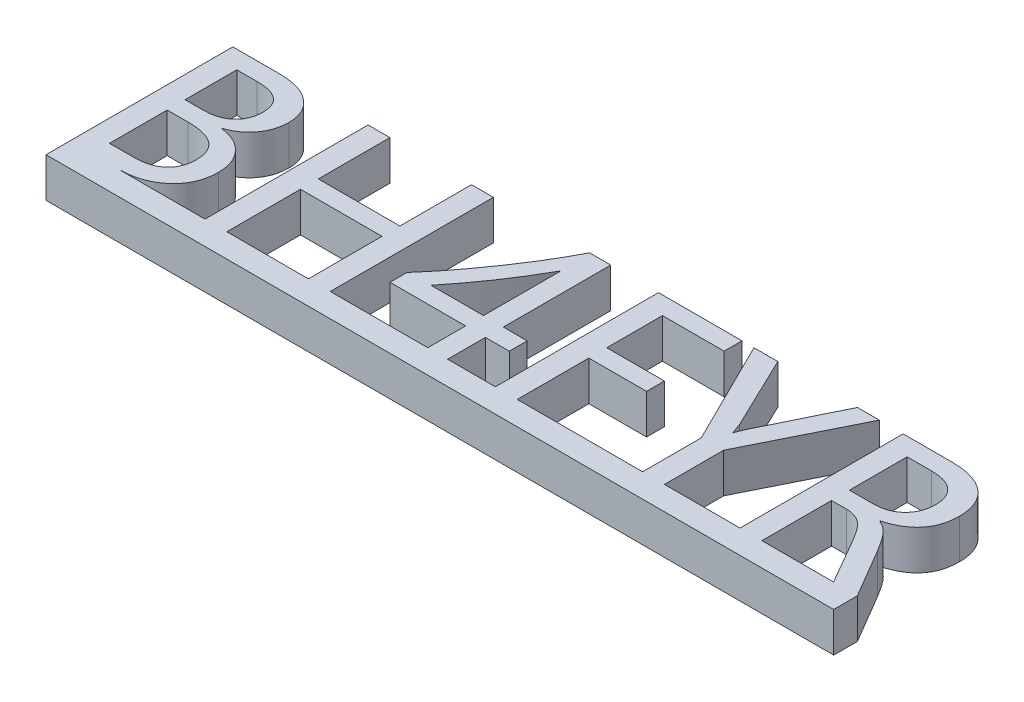
from build123d import *

# Parameters (mm, degrees)
EXTRUDE_1_DEPTH   = 5
EXTRUDE_1_2_DEPTH = 5
EXTRUDE_1_3_DEPTH = 5
EXTRUDE_1_4_DEPTH = 5
EXTRUDE_1_5_DEPTH = 5
EXTRUDE_1_6_DEPTH = 5
SKETCH_2_W        = 99.604130145
SKETCH_2_H        = 5
EXTRUDE_2_DEPTH   = 3


with BuildPart() as part:
    # 草图1 → 凸台-拉伸1 (new body)
    with BuildSketch(Plane(origin=(0, 0, 0), x_dir=(1, 0, 0), z_dir=(0, 1, 0))):
        with BuildLine():
            Line((-60.603252627, 13.579293004), (-60.603252627, 34.20439066))
            Line((-60.603252627, 34.20439066), (-54.645240423, 34.20439066))
            add(Edge.make_bspline(
                [(-54.645240423, 34.20439066), (-54.428893814, 34.201297742), (-54.005718834, 34.195247979), (-53.387768051, 34.128118516), (-52.800842266, 34.03405137), (-52.248046677, 33.892656612), (-51.730624922, 33.706297073), (-51.245419018, 33.483374879), (-50.79476649, 33.217538165), (-50.37779163, 32.917466537), (-50.006483529, 32.578643253), (-49.674636573, 32.216605934), (-49.399805291, 31.821509994), (-49.173552021, 31.400640485), (-48.995834941, 30.955192463), (-48.869510035, 30.48180239), (-48.793729306, 29.982018115), (-48.785658545, 29.63920602), (-48.781550311, 29.46470549)],
                knots=[0, 0, 0, 0, 1.224261737, 2.394661691, 3.515146388, 4.587215054, 5.619395989, 6.624798919, 7.605471068, 8.57712794, 9.527493793, 10.446434834, 11.351717401, 12.244303816, 13.146360503, 14.060259964, 15.012620412, 16, 16, 16, 16], degree=3))
            add(Edge.make_bspline(
                [(-48.781550311, 29.46470549), (-48.784780646, 29.324420511), (-48.791136054, 29.048421733), (-48.835315401, 28.639708576), (-48.908541615, 28.243695122), (-49.016759417, 27.860780673), (-49.149475973, 27.4892236), (-49.31518073, 27.132232899), (-49.509816053, 26.786724577), (-49.73220967, 26.455869473), (-49.979238638, 26.140705184), (-50.251536537, 25.849005244), (-50.547163938, 25.580570614), (-50.866463452, 25.337923737), (-51.204752951, 25.114935736), (-51.570116178, 24.924215876), (-51.953656087, 24.749400431), (-52.222198507, 24.65488783), (-52.357929669, 24.607117704)],
                knots=[0, 0, 0, 0, 1.04030745, 2.046716516, 3.045215807, 4.023467983, 4.994650581, 5.968405467, 6.93851832, 7.932849284, 8.922183699, 9.905200704, 10.888793697, 11.879844052, 12.87692428, 13.889644648, 14.933349214, 16, 16, 16, 16], degree=3))
            Line((-52.357929669, 24.607117704), (-52.357929669, 24.552096483))
            add(Edge.make_bspline(
                [(-52.357929669, 24.552096483), (-52.188572445, 24.528155982), (-51.855559113, 24.481080896), (-51.370405404, 24.372937401), (-50.913322579, 24.22033896), (-50.47977258, 24.04277619), (-50.075431205, 23.823398209), (-49.698196045, 23.571799582), (-49.343895409, 23.286718525), (-49.020871361, 22.964957143), (-48.72593114, 22.618487984), (-48.472905964, 22.244223552), (-48.255399116, 21.850374757), (-48.07679342, 21.432219183), (-47.945230428, 20.98834216), (-47.846132826, 20.523403635), (-47.78638833, 20.035357641), (-47.779134681, 19.702533982), (-47.775447987, 19.533375121)],
                knots=[0, 0, 0, 0, 1.092706737, 2.148629406, 3.170390158, 4.168422902, 5.138436716, 6.104215669, 7.06245633, 8.03909295, 9.013323217, 9.965217964, 10.920529338, 11.884456504, 12.864208971, 13.873863167, 14.919383061, 16, 16, 16, 16], degree=3))
            add(Edge.make_bspline(
                [(-47.775447987, 19.533375121), (-47.779792867, 19.31685208), (-47.788338371, 18.890994847), (-47.883387818, 18.270146806), (-48.025370695, 17.678279683), (-48.237193031, 17.12225777), (-48.500880384, 16.595317861), (-48.825396109, 16.099665648), (-49.214037102, 15.640352447), (-49.652411091, 15.212253137), (-50.138608195, 14.82986393), (-50.660328633, 14.493044626), (-51.215612128, 14.208899094), (-51.805694782, 13.982333149), (-52.425596129, 13.799725952), (-53.079207526, 13.670554869), (-53.767111899, 13.596311871), (-54.236331466, 13.585050845), (-54.476246673, 13.579293004)],
                knots=[0, 0, 0, 0, 1.031947005, 2.029632022, 2.988950409, 3.930190083, 4.860749625, 5.794889745, 6.748554408, 7.725117402, 8.712713111, 9.693743881, 10.68301842, 11.682111326, 12.704383645, 13.761949426, 14.855669279, 16, 16, 16, 16], degree=3))
            Line((-54.476246673, 13.579293004), (-60.603252627, 13.579293004))
        make_face()
        with BuildLine():
            Line((-57.836471234, 31.94066043), (-57.836471234, 25.400995319))
            Line((-57.836471234, 25.400995319), (-55.509859608, 25.400995319))
            add(Edge.make_bspline(
                [(-55.509859608, 25.400995319), (-55.359102608, 25.404174872), (-55.06611866, 25.410354074), (-54.638921385, 25.453579939), (-54.237473835, 25.526777994), (-53.861854216, 25.634191822), (-53.510426824, 25.767678629), (-53.181633516, 25.928970915), (-52.877268139, 26.121254581), (-52.603131224, 26.347120729), (-52.352451198, 26.594588196), (-52.137027666, 26.869898013), (-51.954563306, 27.16823961), (-51.803635125, 27.487852925), (-51.691278759, 27.83171658), (-51.608291059, 28.197341996), (-51.555936339, 28.585470773), (-51.550901371, 28.852753466), (-51.548331704, 28.989164938)],
                knots=[0, 0, 0, 0, 1.194671247, 2.321746236, 3.398942989, 4.424310126, 5.413453364, 6.374575168, 7.32214346, 8.259360503, 9.184364407, 10.108610566, 11.022064294, 11.950963703, 12.90307127, 13.882798053, 14.919456278, 16, 16, 16, 16], degree=3))
            add(Edge.make_bspline(
                [(-51.548331704, 28.989164938), (-51.55143959, 29.10851691), (-51.55747183, 29.340172697), (-51.601410673, 29.675698436), (-51.671428335, 29.989560044), (-51.771796982, 30.281116036), (-51.909108484, 30.546969664), (-52.068105787, 30.792189272), (-52.261443312, 31.009861187), (-52.478370865, 31.210560448), (-52.731071455, 31.380350142), (-53.010099139, 31.531425316), (-53.315912189, 31.661919702), (-53.6543002, 31.761490788), (-54.018622797, 31.846110174), (-54.4148803, 31.89728874), (-54.838403522, 31.934814627), (-55.13116635, 31.938673457), (-55.28191455, 31.94066043)],
                knots=[0, 0, 0, 0, 1.053285166, 2.044370124, 2.981290725, 3.888262112, 4.757057278, 5.616568525, 6.46069648, 7.320207727, 8.218289928, 9.139305578, 10.118650866, 11.146493088, 12.248964571, 13.416581374, 14.669756982, 16, 16, 16, 16], degree=3))
            Line((-55.28191455, 31.94066043), (-57.836471234, 31.94066043))
        make_face(mode=Mode.SUBTRACT)
        with BuildLine():
            Line((-57.836471234, 23.137265089), (-57.836471234, 15.843023235))
            Line((-57.836471234, 15.843023235), (-54.755282864, 15.843023235))
            add(Edge.make_bspline(
                [(-54.755282864, 15.843023235), (-54.59139082, 15.845726189), (-54.273369973, 15.85097108), (-53.811345998, 15.900470721), (-53.377229266, 15.972954372), (-52.971664667, 16.078293868), (-52.595129293, 16.216455443), (-52.247145008, 16.38583027), (-51.928116587, 16.586093536), (-51.63934708, 16.816587404), (-51.377867057, 17.070822921), (-51.155162677, 17.355385115), (-50.962125195, 17.660889244), (-50.811704327, 17.992856341), (-50.686589918, 18.345760495), (-50.602224153, 18.724425785), (-50.549732845, 19.127083964), (-50.544771693, 19.403511624), (-50.54222938, 19.545165383)],
                knots=[0, 0, 0, 0, 1.234915879, 2.396266363, 3.498520061, 4.549933063, 5.54962698, 6.516751377, 7.461900337, 8.382540583, 9.297230871, 10.203998833, 11.099949659, 12.014426733, 12.945021275, 13.917524352, 14.932847372, 16, 16, 16, 16], degree=3))
            add(Edge.make_bspline(
                [(-50.54222938, 19.545165383), (-50.546417703, 19.690727266), (-50.554519353, 19.972293757), (-50.605186974, 20.382014843), (-50.693362656, 20.763966566), (-50.826117179, 21.115541945), (-50.985915819, 21.442732127), (-51.188944283, 21.738720337), (-51.426484206, 22.007976236), (-51.699000287, 22.249271196), (-52.009955236, 22.459478204), (-52.35848083, 22.638157605), (-52.739795614, 22.797271454), (-53.159344999, 22.920926422), (-53.612605442, 23.018571636), (-54.10224866, 23.089857993), (-54.628954888, 23.12663613), (-54.992348497, 23.133648937), (-55.179732283, 23.137265089)],
                knots=[0, 0, 0, 0, 1.043087874, 2.017688869, 2.95354105, 3.844628149, 4.705278241, 5.556714445, 6.408047138, 7.272630541, 8.157913097, 9.09008545, 10.075075167, 11.114523712, 12.219321121, 13.395592654, 14.657038276, 16, 16, 16, 16], degree=3))
            Line((-55.179732283, 23.137265089), (-57.836471234, 23.137265089))
        make_face(mode=Mode.SUBTRACT)
    extrude(amount=EXTRUDE_1_DEPTH)



with BuildPart() as body_2:
    # 草图1 → Extrude 1 2 (new body)
    with BuildSketch(Plane(origin=(0, 0, 0), x_dir=(1, 0, 0), z_dir=(0, 1, 0))):
        Polygon((-27.653401493, 13.579293004), (-30.420182886, 13.579293004), (-30.420182886, 22.885739508), (-40.732731714, 22.885739508), (-40.732731714, 13.579293004), (-43.499513107, 13.579293004), (-43.499513107, 34.20439066), (-40.732731714, 34.20439066), (-40.732731714, 25.149469738), (-30.420182886, 25.149469738), (-30.420182886, 34.20439066), (-27.653401493, 34.20439066), align=None)
    extrude(amount=EXTRUDE_1_2_DEPTH)


with BuildPart() as body_3:
    # 草图1 → Extrude 1 3 (new body)
    with BuildSketch(Plane(origin=(0, 0, 0), x_dir=(1, 0, 0), z_dir=(0, 1, 0))):
        with BuildLine():
            Line((-12.813392204, 34.20439066), (-12.813392204, 20.622009277))
            Line((-12.813392204, 20.622009277), (-9.795085229, 20.622009277))
            Line((-9.795085229, 20.622009277), (-9.795085229, 18.358279046))
            Line((-9.795085229, 18.358279046), (-12.813392204, 18.358279046))
            Line((-12.813392204, 18.358279046), (-12.813392204, 13.579293004))
            Line((-12.813392204, 13.579293004), (-15.328648015, 13.579293004))
            Line((-15.328648015, 13.579293004), (-15.328648015, 18.358279046))
            Line((-15.328648015, 18.358279046), (-24.8866201, 18.358279046))
            Line((-24.8866201, 18.358279046), (-24.8866201, 20.504106661))
            add(Edge.make_bspline(
                [(-24.8866201, 20.504106661), (-24.457193161, 20.998846905), (-23.578585111, 22.011086056), (-22.303006444, 23.621057629), (-21.021282196, 25.338361795), (-19.961945969, 26.833617371), (-19.131929687, 28.066204256), (-18.526339968, 28.982712032), (-17.953108861, 29.887983683), (-17.405471785, 30.776782908), (-16.886630424, 31.651295187), (-16.399771445, 32.515186534), (-15.934205465, 33.360574991), (-15.644330363, 33.925952129), (-15.501571852, 34.20439066)],
                knots=[0, 0, 0, 0, 1.416740294, 2.898652394, 4.441123769, 6.05109865, 6.86129983, 7.654998932, 8.426874509, 9.17862826, 9.912856759, 10.625918725, 11.323288568, 12, 12, 12, 12], degree=3))
            Line((-15.501571852, 34.20439066), (-12.813392204, 34.20439066))
        make_face()
        with BuildLine():
            Line((-21.966565306, 20.622009277), (-15.328648015, 20.622009277))
            Line((-15.328648015, 20.622009277), (-15.328648015, 30.419716681))
            add(Edge.make_bspline(
                [(-15.328648015, 30.419716681), (-15.559764648, 30.007172568), (-16.020610026, 29.184561724), (-16.747965627, 27.973562899), (-17.492446423, 26.777535961), (-18.273914325, 25.594101369), (-19.099808752, 24.398431791), (-19.988176403, 23.173226194), (-20.94802573, 21.906676082), (-21.621705229, 21.056975481), (-21.966565306, 20.622009277)],
                knots=[0, 0, 0, 0, 0.957687981, 1.909624916, 2.860807221, 3.810856455, 4.781631678, 5.803821085, 6.875764471, 8, 8, 8, 8], degree=3))
        make_face(mode=Mode.SUBTRACT)
    extrude(amount=EXTRUDE_1_3_DEPTH)


with BuildPart() as body_4:
    # 草图1 → Extrude 1 4 (new body)
    with BuildSketch(Plane(origin=(0, 0, 0), x_dir=(1, 0, 0), z_dir=(0, 1, 0))):
        Polygon((3.787296154, 31.94066043), (-4.009996862, 31.94066043), (-4.009996862, 24.897944157), (3.284244992, 24.897944157), (3.284244992, 22.634213926), (-4.009996862, 22.634213926), (-4.009996862, 13.579293004), (-6.776778255, 13.579293004), (-6.776778255, 34.20439066), (3.787296154, 34.20439066), align=None)
    extrude(amount=EXTRUDE_1_4_DEPTH)


with BuildPart() as body_5:
    # 草图1 → Extrude 1 5 (new body)
    with BuildSketch(Plane(origin=(0, 0, 0), x_dir=(1, 0, 0), z_dir=(0, 1, 0))):
        with BuildLine():
            Line((21.142561255, 34.20439066), (14.602896144, 21.062179044))
            Line((14.602896144, 21.062179044), (14.602896144, 13.579293004))
            Line((14.602896144, 13.579293004), (11.836114751, 13.579293004))
            Line((11.836114751, 13.579293004), (11.836114751, 20.995367562))
            Line((11.836114751, 20.995367562), (5.296449641, 34.20439066))
            Line((5.296449641, 34.20439066), (8.314756615, 34.20439066))
            Line((8.314756615, 34.20439066), (12.775405594, 24.917594593))
            add(Edge.make_bspline(
                [(12.775405594, 24.917594593), (12.779462812, 24.909789929), (12.793855105, 24.882104213), (12.8150552, 24.816288906), (12.855842399, 24.710841435), (12.910211629, 24.562987824), (12.976058258, 24.373546715), (13.059934212, 24.144766251), (13.157130511, 23.874519411), (13.228528257, 23.680873753), (13.266666494, 23.577434856)],
                knots=[0, 0, 0, 0, 0.147743287, 0.524094158, 1.158224838, 2.050139749, 3.171648737, 4.530208759, 6.146556032, 8, 8, 8, 8], degree=3))
            Line((13.266666494, 23.577434856), (13.305967366, 23.577434856))
            add(Edge.make_bspline(
                [(13.305967366, 23.577434856), (13.33484103, 23.677404097), (13.395123965, 23.886121612), (13.516204335, 24.207118537), (13.665166144, 24.549729806), (13.778076917, 24.784346679), (13.836529139, 24.905804331)],
                knots=[0, 0, 0, 0, 0.871330364, 1.819178638, 2.871021336, 4, 4, 4, 4], degree=3))
            Line((13.836529139, 24.905804331), (18.375779862, 34.20439066))
            Line((18.375779862, 34.20439066), (21.142561255, 34.20439066))
        make_face()
    extrude(amount=EXTRUDE_1_5_DEPTH)


with BuildPart() as body_6:
    # 草图1 → Extrude 1 6 (new body)
    with BuildSketch(Plane(origin=(0, 0, 0), x_dir=(1, 0, 0), z_dir=(0, 1, 0))):
        with BuildLine():
            Line((39.000877518, 13.579293004), (35.982570544, 13.579293004))
            Line((35.982570544, 13.579293004), (32.634136245, 19.384031807))
            add(Edge.make_bspline(
                [(32.634136245, 19.384031807), (32.552383014, 19.523363245), (32.39374497, 19.793728911), (32.151782207, 20.17679705), (31.91435823, 20.525370648), (31.683789714, 20.839823269), (31.456594646, 21.120283809), (31.23093888, 21.363060439), (31.017925264, 21.578459515), (30.734092963, 21.80728338), (30.365263918, 22.043704536), (29.878949931, 22.239872232), (29.353258482, 22.361842913), (28.989007671, 22.375624319), (28.802301219, 22.382688345)],
                knots=[0, 0, 0, 0, 1.130740819, 2.194145845, 3.170827357, 4.082355974, 4.923051463, 5.695349335, 6.402154369, 7.0409034, 8.244273015, 9.453324277, 10.69463355, 12, 12, 12, 12], degree=3))
            Line((28.802301219, 22.382688345), (26.927649622, 22.382688345))
            Line((26.927649622, 22.382688345), (26.927649622, 13.579293004))
            Line((26.927649622, 13.579293004), (24.160868229, 13.579293004))
            Line((24.160868229, 13.579293004), (24.160868229, 34.20439066))
            Line((24.160868229, 34.20439066), (30.382196276, 34.20439066))
            add(Edge.make_bspline(
                [(30.382196276, 34.20439066), (30.623407887, 34.199838673), (31.093686119, 34.19096389), (31.779177596, 34.1227643), (32.426230245, 34.014983369), (33.033173664, 33.858939385), (33.598415441, 33.653273954), (34.123647868, 33.405093529), (34.610936823, 33.115098632), (35.051120894, 32.774299374), (35.4495557, 32.399252534), (35.795356459, 31.982084566), (36.085416048, 31.528110627), (36.329287045, 31.040706736), (36.512609496, 30.51598985), (36.641734679, 29.955830207), (36.72149504, 29.360882281), (36.731843387, 28.951429), (36.737147288, 28.741569444)],
                knots=[0, 0, 0, 0, 1.218895871, 2.376420411, 3.477962383, 4.53141632, 5.538862009, 6.513239363, 7.463634743, 8.398567947, 9.321158646, 10.2239854, 11.129406106, 12.03842662, 12.972374671, 13.931150821, 14.93964027, 16, 16, 16, 16], degree=3))
            add(Edge.make_bspline(
                [(36.737147288, 28.741569444), (36.734957999, 28.568470155), (36.730650563, 28.227896386), (36.672254937, 27.730404595), (36.588030053, 27.255492829), (36.465076657, 26.804580866), (36.308243414, 26.37557001), (36.116611492, 25.969163283), (35.884568012, 25.590407414), (35.626235694, 25.229093675), (35.325300283, 24.895073044), (34.989915902, 24.585150697), (34.624055934, 24.295208328), (34.217524675, 24.037959378), (33.783577157, 23.791526173), (33.30873386, 23.577548086), (32.801178877, 23.383227065), (32.446274784, 23.277709262), (32.264708047, 23.223727007)],
                knots=[0, 0, 0, 0, 1.074656955, 2.114393259, 3.107181087, 4.068555706, 5.013394394, 5.941580924, 6.854299593, 7.76908369, 8.696949116, 9.641262007, 10.603359607, 11.592003282, 12.626631854, 13.700826558, 14.823757099, 16, 16, 16, 16], degree=3))
            Line((32.264708047, 23.223727007), (32.264708047, 23.156915525))
            add(Edge.make_bspline(
                [(32.264708047, 23.156915525), (32.402500436, 23.093055253), (32.676603505, 22.966021411), (33.058661307, 22.723873878), (33.411251839, 22.442597377), (33.682596637, 22.172927081), (33.895287298, 21.929482631), (34.062945939, 21.713962464), (34.251294688, 21.476148942), (34.439302473, 21.198348854), (34.649383389, 20.898750352), (34.865158411, 20.566061828), (35.093484935, 20.204687922), (35.24676355, 19.951540671), (35.326245981, 19.820271487)],
                knots=[0, 0, 0, 0, 1.184822924, 2.356905208, 3.521464881, 4.700445098, 5.338415513, 6.044500847, 6.832186772, 7.706197801, 8.662360415, 9.68937721, 10.801829505, 12, 12, 12, 12], degree=3))
            Line((35.326245981, 19.820271487), (39.000877518, 13.579293004))
        make_face()
        with BuildLine():
            Line((26.927649622, 31.94066043), (26.927649622, 24.646418576))
            Line((26.927649622, 24.646418576), (29.981327381, 24.646418576))
            add(Edge.make_bspline(
                [(29.981327381, 24.646418576), (30.125611588, 24.648904989), (30.408581538, 24.653781337), (30.822414175, 24.707780663), (31.216689837, 24.787390435), (31.588490315, 24.90736891), (31.939838801, 25.057093452), (32.272266748, 25.237124469), (32.58095761, 25.456182969), (32.866334015, 25.706784543), (33.125126684, 25.984151101), (33.350174355, 26.285528035), (33.543963805, 26.604544007), (33.703933737, 26.944849426), (33.819458658, 27.309164642), (33.905434151, 27.69176134), (33.964125284, 28.095240478), (33.968252329, 28.371926425), (33.970365895, 28.513624386)],
                knots=[0, 0, 0, 0, 1.107295592, 2.171626293, 3.199536045, 4.192135932, 5.165640131, 6.129060805, 7.089167039, 8.0657848, 9.040950802, 9.996619902, 10.948947584, 11.903080024, 12.876532246, 13.877103319, 14.912810223, 16, 16, 16, 16], degree=3))
            add(Edge.make_bspline(
                [(33.970365895, 28.513624386), (33.967550699, 28.644782631), (33.962069875, 28.900130868), (33.913540384, 29.272432151), (33.836222087, 29.622919201), (33.725860473, 29.951132134), (33.583767232, 30.258022739), (33.405677606, 30.539863907), (33.200598435, 30.802371301), (32.962585734, 31.039294012), (32.694986794, 31.251529598), (32.397357678, 31.437814904), (32.071682651, 31.594331237), (31.71531186, 31.720216524), (31.33322166, 31.82207394), (30.920255532, 31.89285583), (30.479828491, 31.930041742), (30.176586085, 31.937054013), (30.020628253, 31.94066043)],
                knots=[0, 0, 0, 0, 1.058384684, 2.060538898, 3.025220841, 3.951579121, 4.850487263, 5.748399523, 6.636984035, 7.534335625, 8.452630291, 9.388656851, 10.363028537, 11.363227871, 12.435470195, 13.551662397, 14.740817851, 16, 16, 16, 16], degree=3))
            Line((30.020628253, 31.94066043), (26.927649622, 31.94066043))
        make_face(mode=Mode.SUBTRACT)
    extrude(amount=EXTRUDE_1_6_DEPTH)


with BuildPart() as part_1:
    add(part.part)

    add(body_2.part)  # 凸台-拉伸2 merges body 2

    add(body_3.part)  # 凸台-拉伸2 merges body 3

    add(body_4.part)  # 凸台-拉伸2 merges body 4

    add(body_5.part)  # 凸台-拉伸2 merges body 5

    add(body_6.part)  # 凸台-拉伸2 merges body 6
    # 草图2 → 凸台-拉伸2 (add)
    with BuildSketch(Plane.XY.offset(-13.579293004)):
        with Locations((-10.801187555, 2.5)):
            Rectangle(SKETCH_2_W, SKETCH_2_H)
    extrude(amount=EXTRUDE_2_DEPTH)


solid = part_1.part
